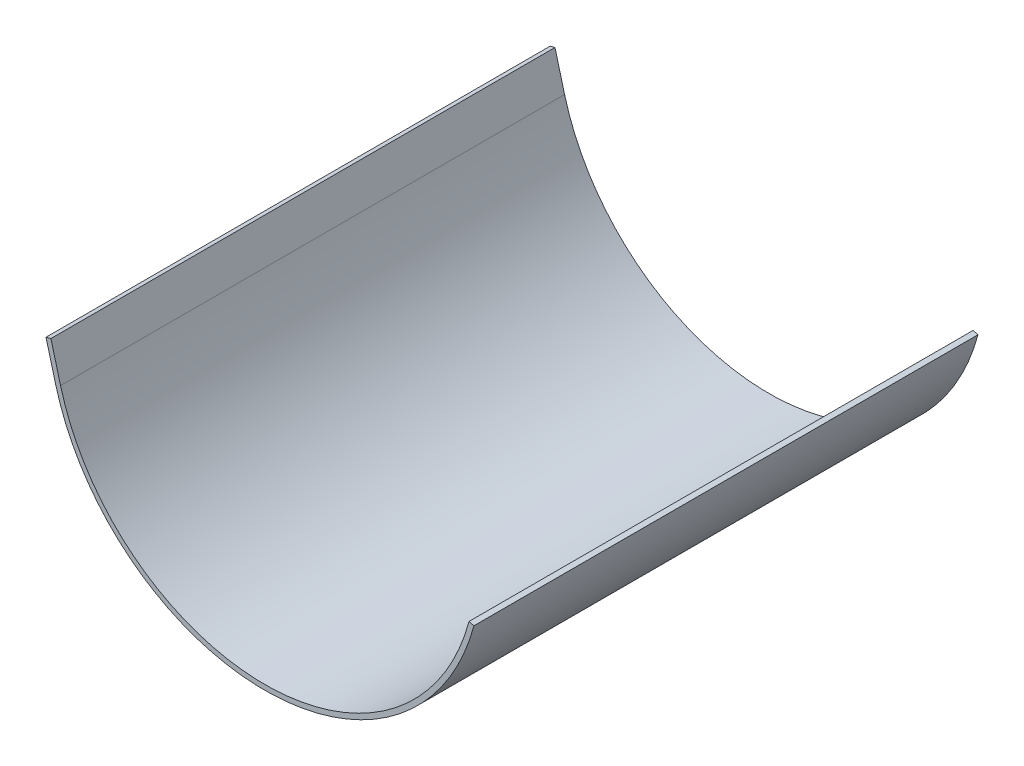
from build123d import *

# Parameters (mm, degrees)
BOSS_EXTRUDE1_DEPTH = 74.5
SKETCH2_W           = 1.5
SKETCH2_H           = 149
BOSS_EXTRUDE2_DEPTH = 11


with BuildPart() as part:
    # Sketch1 → Boss-Extrude1 (new, symmetric)
    with BuildSketch(Plane.XY):
        with BuildLine():
            Line((61.819252883, -16.564418887), (60.370364143, -16.176190319))
            ThreePointArc((60.370364143, -16.176190319), (0, -62.5), (-60.370364143, -16.176190319))
            Line((-60.370364143, -16.176190319), (-61.819252883, -16.564418887))
            ThreePointArc((-61.819252883, -16.564418887), (0, -64), (61.819252883, -16.564418887))
        make_face()
    extrude(amount=BOSS_EXTRUDE1_DEPTH, both=True)

    # Sketch2 → Boss-Extrude2 (add)
    with BuildSketch(Plane(origin=(0, 0, 0), x_dir=(0.9659258262890683, 0.25881904510252113, 0), z_dir=(-0.25881904510252113, 0.9659258262890683, 0))):
        with Locations((-63.25, 0)):
            Rectangle(SKETCH2_W, SKETCH2_H)
    extrude(amount=BOSS_EXTRUDE2_DEPTH)


solid = part.part
